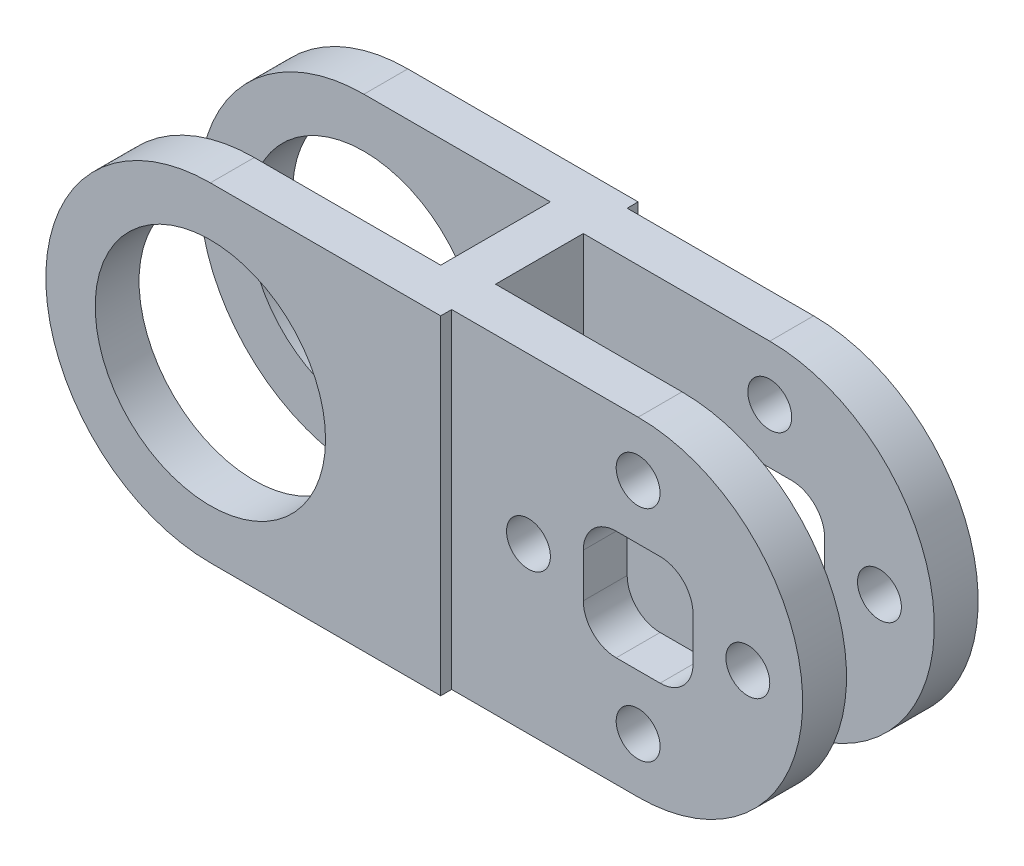
from build123d import *

# Parameters (mm, degrees)
EXTRUDE_1_DEPTH     = 18
SKETCH_2_W          = 32
SKETCH_2_H          = 12
CUT_EXTRUDE_1_DEPTH = 34
SKETCH_3_W          = 32
SKETCH_3_H          = 8
CUT_EXTRUDE_2_DEPTH = 34
SKETCH_4_R          = 10.5
CUT_EXTRUDE_3_DEPTH = 34
SKETCH_5_W          = 36.797591779
SKETCH_5_H          = 31.340238438
CUT_EXTRUDE_4_DEPTH = 2
SKETCH_6_W          = 48.194095428
SKETCH_6_H          = 31.947752294
CUT_EXTRUDE_5_DEPTH = 2
SKETCH_7_R          = 2
CUT_EXTRUDE_6_DEPTH = 20
SKETCH_8_W          = 5
SKETCH_8_H          = 10
CUT_EXTRUDE_7_DEPTH = 20
SKETCH_9_R          = 10.5
EXTRUDE_2_DEPTH     = 4
SKETCH_10_R         = 10.5
EXTRUDE_3_DEPTH     = 4
SKETCH_11_R         = 2
SKETCH_11_W         = 5
SKETCH_11_H         = 10
EXTRUDE_4_DEPTH     = 1
EXTRUDE_START       = 1
SKETCH_12_R         = 2
SKETCH_12_W         = 5
SKETCH_12_H         = 10
EXTRUDE_5_DEPTH     = 1
SKETCH_13_W         = 5
SKETCH_13_H         = 10
CUT_EXTRUDE_8_DEPTH = 19
FILLET_1_R          = 3


with BuildPart() as part:
    # 草图1 → 凸台-拉伸1 (new body)
    with BuildSketch(Plane.XY):
        with BuildLine():
            Line((0, 15), (38, 15))
            ThreePointArc((38, 15), (53, 0), (38, -15))
            Line((38, -15), (0, -15))
            ThreePointArc((0, -15), (-15, 0), (0, 15))
        make_face()
    extrude(amount=EXTRUDE_1_DEPTH)

    # 草图2 → 切除-拉伸1 (cut)
    with BuildSketch(Plane(origin=(0, 15, 0), x_dir=(1, 0, 0), z_dir=(0, 1, 0))):
        with Locations((1, -9)):
            Rectangle(SKETCH_2_W, SKETCH_2_H)
    extrude(amount=-CUT_EXTRUDE_1_DEPTH, mode=Mode.SUBTRACT)

    # 草图3 → 切除-拉伸2 (cut)
    with BuildSketch(Plane(origin=(0, 15, 0), x_dir=(1, 0, 0), z_dir=(0, 1, 0))):
        with Locations((37, -9)):
            Rectangle(SKETCH_3_W, SKETCH_3_H)
    extrude(amount=-CUT_EXTRUDE_2_DEPTH, mode=Mode.SUBTRACT)

    # 草图4 → 切除-拉伸3 (cut)
    with BuildSketch(Plane.XY.offset(18)):
        Circle(SKETCH_4_R)
    extrude(amount=-CUT_EXTRUDE_3_DEPTH, mode=Mode.SUBTRACT)

    # 草图5 → 切除-拉伸4 (cut)
    with BuildSketch(Plane.XY.offset(18)):
        with Locations((39.39879589, -0.670119219)):
            Rectangle(SKETCH_5_W, SKETCH_5_H)
    extrude(amount=-CUT_EXTRUDE_4_DEPTH, mode=Mode.SUBTRACT)

    # 草图6 → 切除-拉伸5 (cut)
    with BuildSketch(Plane(origin=(0, 0, 0), x_dir=(-1, 0, 0), z_dir=(0, 0, -1))):
        with Locations((-45.097047714, -0.973876147)):
            Rectangle(SKETCH_6_W, SKETCH_6_H)
    extrude(amount=-CUT_EXTRUDE_5_DEPTH, mode=Mode.SUBTRACT)

    # 草图7 → 切除-拉伸6 (cut)
    with BuildSketch(Plane(origin=(0, 0, 2), x_dir=(-1, 0, 0), z_dir=(0, 0, -1))):
        with Locations((-48, 0)):
            Circle(SKETCH_7_R)
        with Locations((-38, 10)):
            Circle(SKETCH_7_R)
        with Locations((-28, 0)):
            Circle(SKETCH_7_R)
        with Locations((-38, -10)):
            Circle(SKETCH_7_R)
    extrude(amount=-CUT_EXTRUDE_6_DEPTH, mode=Mode.SUBTRACT)

    # 草图8 → 切除-拉伸7 (cut)
    with BuildSketch(Plane(origin=(0, 0, 2), x_dir=(-1, 0, 0), z_dir=(0, 0, -1))):
        with Locations((-35.5, 0)):
            Rectangle(SKETCH_8_W, SKETCH_8_H)
    extrude(amount=-CUT_EXTRUDE_7_DEPTH, mode=Mode.SUBTRACT)

    # 草图9 → 凸台-拉伸2 (add)
    with BuildSketch(Plane(origin=(0, 0, 0), x_dir=(-1, 0, 0), z_dir=(0, 0, -1))):
        with BuildLine():
            Line((0, 15), (-21, 15))
            Line((-21, 15), (-21, -15))
            Line((-21, -15), (0, -15))
            ThreePointArc((0, -15), (15, 0), (0, 15))
        make_face()
        with Locations(Location((0, 0, 0), (0, 0, 180))):
            Circle(SKETCH_9_R, mode=Mode.SUBTRACT)
    extrude(amount=-EXTRUDE_2_DEPTH)

    # 草图10 → 凸台-拉伸3 (add)
    with BuildSketch(Plane.XY.offset(18)):
        with BuildLine():
            Line((21, -15), (21, 15))
            Line((21, 15), (0, 15))
            ThreePointArc((0, 15), (-15, 0), (0, -15))
            Line((0, -15), (21, -15))
        make_face()
        Circle(SKETCH_10_R, mode=Mode.SUBTRACT)
    extrude(amount=-EXTRUDE_3_DEPTH)

    # 草图11 → 凸台-拉伸4 (add)
    with BuildSketch(Plane.XY.offset(16)):
        with BuildLine():
            Line((21, -15), (38, -15))
            ThreePointArc((38, -15), (53, 0), (38, 15))
            Line((38, 15), (21, 15))
            Line((21, 15), (21, -15))
        make_face()
        with Locations(Location((38, 10, 0), (0, 0, 180))):
            Circle(SKETCH_11_R, mode=Mode.SUBTRACT)
        with Locations(Location((38, -10, 0), (0, 0, 180))):
            Circle(SKETCH_11_R, mode=Mode.SUBTRACT)
        with Locations(Location((28, 0, 0), (0, 0, 180))):
            Circle(SKETCH_11_R, mode=Mode.SUBTRACT)
        with Locations(Location((48, 0, 0), (0, 0, 180))):
            Circle(SKETCH_11_R, mode=Mode.SUBTRACT)
        with Locations((35.5, 0)):
            Rectangle(SKETCH_11_W, SKETCH_11_H, mode=Mode.SUBTRACT)
    extrude(amount=EXTRUDE_4_DEPTH)

    # 草图12 → 凸台-拉伸5 (add)
    with BuildSketch(Plane(origin=(0, 0, 2), x_dir=(-1, 0, 0), z_dir=(0, 0, -1)).offset(EXTRUDE_START)):
        with BuildLine():
            Line((-21, -15), (-21, 15))
            Line((-21, 15), (-38, 15))
            ThreePointArc((-38, 15), (-53, 0), (-38, -15))
            Line((-38, -15), (-21, -15))
        make_face()
        with Locations((-48, 0)):
            Circle(SKETCH_12_R, mode=Mode.SUBTRACT)
        with Locations((-38, -10)):
            Circle(SKETCH_12_R, mode=Mode.SUBTRACT)
        with Locations((-28, 0)):
            Circle(SKETCH_12_R, mode=Mode.SUBTRACT)
        with Locations((-38, 10)):
            Circle(SKETCH_12_R, mode=Mode.SUBTRACT)
        with Locations((-35.5, 0)):
            Rectangle(SKETCH_12_W, SKETCH_12_H, mode=Mode.SUBTRACT)
    extrude(amount=-EXTRUDE_5_DEPTH)

    # 草图13 → 切除-拉伸8 (cut)
    with BuildSketch(Plane.XY.offset(17)):
        with Locations((40.5, 0)):
            Rectangle(SKETCH_13_W, SKETCH_13_H)
    extrude(amount=-CUT_EXTRUDE_8_DEPTH, mode=Mode.SUBTRACT)

    # 圆角1
    fillet_1_edges = [part.edges().sort_by_distance(p)[0] for p in [
        (33, 5, 14.5),
        (33, 5, 3),
        (33, -5, 14.5),
        (33, -5, 3),
        (43, 5, 15),
        (43, 5, 3),
        (43, -5, 15),
        (43, -5, 3),
    ]]
    fillet(fillet_1_edges, radius=FILLET_1_R)


solid = part.part
